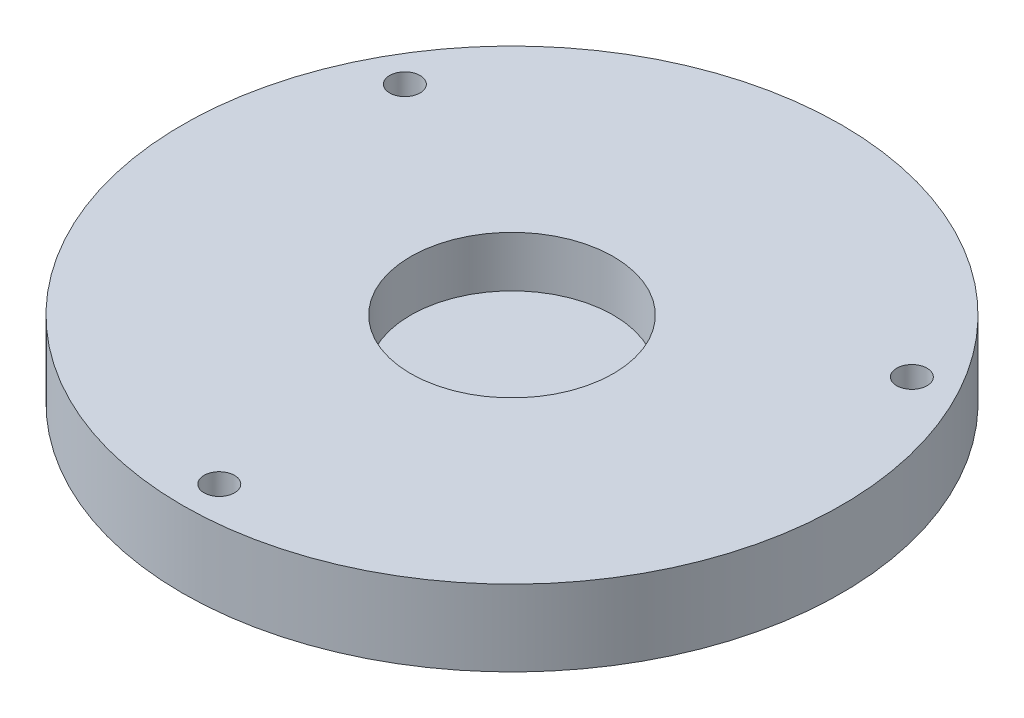
from build123d import *

# Parameters (mm, degrees)
SKETCH_2_R          = 65
EXTRUDE_1_DEPTH     = 15
SKETCH_5_R          = 20
CUT_EXTRUDE_1_DEPTH = 10
SKETCH_6_R          = 3
CUT_EXTRUDE_2_DEPTH = 15


with BuildPart() as part:
    # Эскиз2 → Бобышка-Вытянуть1 (new body)
    with BuildSketch(Plane(origin=(0, 0, 0), x_dir=(1, 0, 0), z_dir=(0, 1, 0))):
        with Locations(Location((0, 0, 0), (0, 0, 270))):
            Circle(SKETCH_2_R)
    extrude(amount=EXTRUDE_1_DEPTH)

    # Эскиз5 → Вырез-Вытянуть1 (cut)
    with BuildSketch(Plane(origin=(0, 15, 0), x_dir=(1, 0, 0), z_dir=(0, 1, 0))):
        with Locations(Location((0, 0, 0), (0, 0, 270))):
            Circle(SKETCH_5_R)
    extrude(amount=-CUT_EXTRUDE_1_DEPTH, mode=Mode.SUBTRACT)

    # Эскиз6 → Вырез-Вытянуть2 (cut)
    with BuildSketch(Plane.XZ):
        with Locations(Location((0, 57.735026919, 0), (0, 0, 270))):
            Circle(SKETCH_6_R)
        with Locations(Location((-50, -28.867513459, 0), (0, 0, 270))):
            Circle(SKETCH_6_R)
        with Locations(Location((50, -28.867513459, 0), (0, 0, 270))):
            Circle(SKETCH_6_R)
    extrude(amount=-CUT_EXTRUDE_2_DEPTH, mode=Mode.SUBTRACT)


solid = part.part
